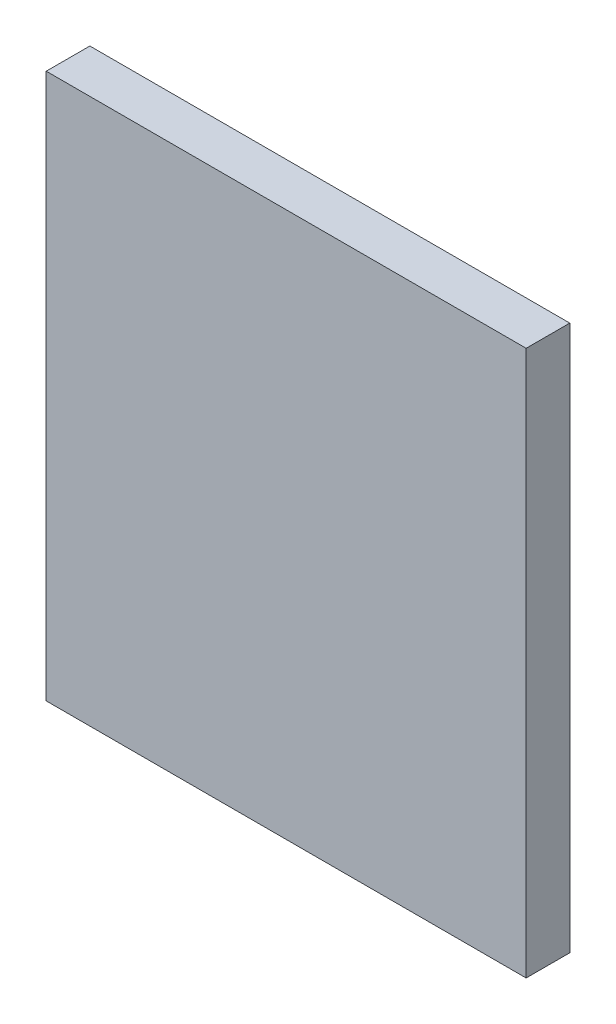
from build123d import *

# Parameters (mm, degrees)
SKETCH1_W           = 22
SKETCH1_H           = 25
BOSS_EXTRUDE1_DEPTH = 2


with BuildPart() as part:
    # Sketch1 → Boss-Extrude1 (new body)
    with BuildSketch(Plane.XY):
        with Locations((11, 12.5)):
            Rectangle(SKETCH1_W, SKETCH1_H)
    extrude(amount=BOSS_EXTRUDE1_DEPTH)


solid = part.part
